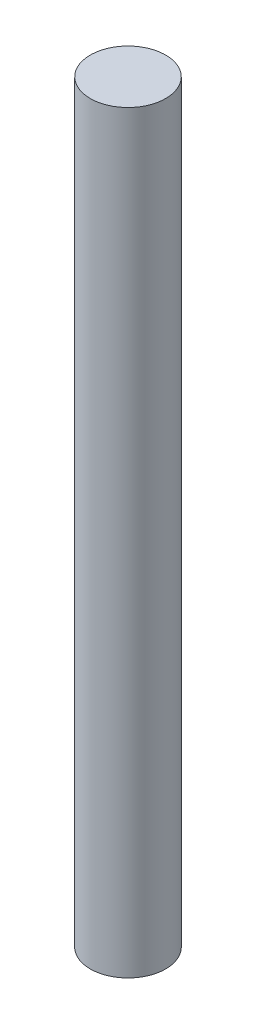
from build123d import *

# Parameters (mm, degrees)
CROQUIS1_R              = 5
SALIENTE_EXTRUIR1_DEPTH = 100


with BuildPart() as part:
    # Croquis1 → Saliente-Extruir1 (new body)
    with BuildSketch(Plane(origin=(0, 0, 0), x_dir=(1, 0, 0), z_dir=(0, 1, 0))):
        with Locations(Location((0, 0, 0), (0, 0, 270))):
            Circle(CROQUIS1_R)
    extrude(amount=SALIENTE_EXTRUIR1_DEPTH)


solid = part.part
